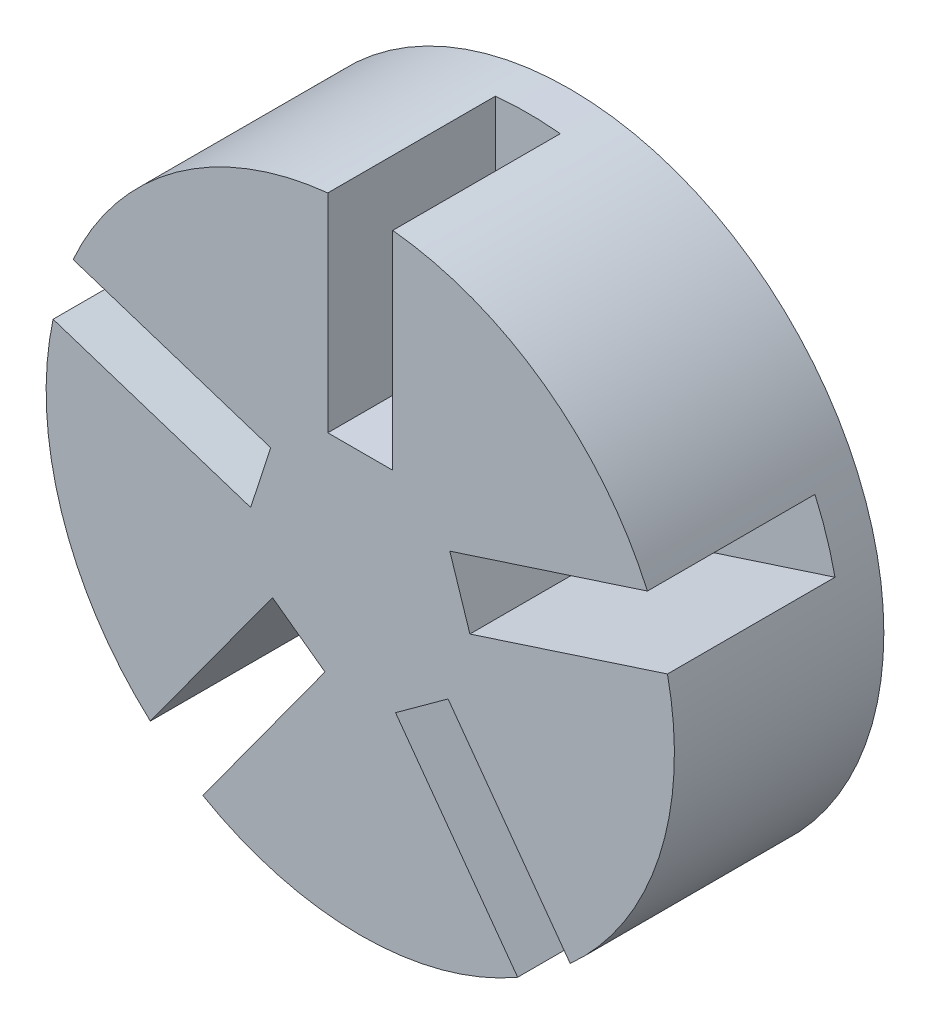
from build123d import *

# Parameters (mm, degrees)
SKETCH_1_R          = 15
EXTRUDE_1_DEPTH     = 10
SKETCH_2_R          = 1.95
EXTRUDE_2_DEPTH     = 4
SKETCH_3_W          = 3.1
SKETCH_3_H          = 25.258877381
CUT_EXTRUDE_1_DEPTH = 8


with BuildPart() as part:
    # 草图1 → 凸台-拉伸1 (new body)
    with BuildSketch(Plane.XY):
        Circle(SKETCH_1_R)
    extrude(amount=EXTRUDE_1_DEPTH)

    # 草图2 → 凸台-拉伸2 (add)
    with BuildSketch(Plane(origin=(0, 0, 0), x_dir=(-1, 0, 0), z_dir=(0, 0, -1))):
        Circle(SKETCH_2_R)
    extrude(amount=EXTRUDE_2_DEPTH)

    # 草图3 → 切除-拉伸1 (cut)
    with BuildSketch(Plane.XY.offset(10)):
        Polygon((29.256878851, 7.876369741), (5.234258923, 0.070947372), (4.27630624, 3.019222572), (28.298926168, 10.824644942), align=None)
        with Locations((0, 17.629438691)):
            Rectangle(SKETCH_3_W, SKETCH_3_H)
        Polygon((16.531745534, -25.391013173), (1.68494992, -4.956152113), (4.192902603, -3.134017831), (19.039698217, -23.568878891), align=None)
        Polygon((-19.039698217, -23.568878891), (-4.192902603, -3.134017831), (-1.68494992, -4.956152113), (-16.531745534, -25.391013173), align=None)
        Polygon((-28.298926168, 10.824644942), (-4.27630624, 3.019222572), (-5.234258923, 0.070947372), (-29.256878851, 7.876369741), align=None)
    extrude(amount=-CUT_EXTRUDE_1_DEPTH, mode=Mode.SUBTRACT)


solid = part.part
